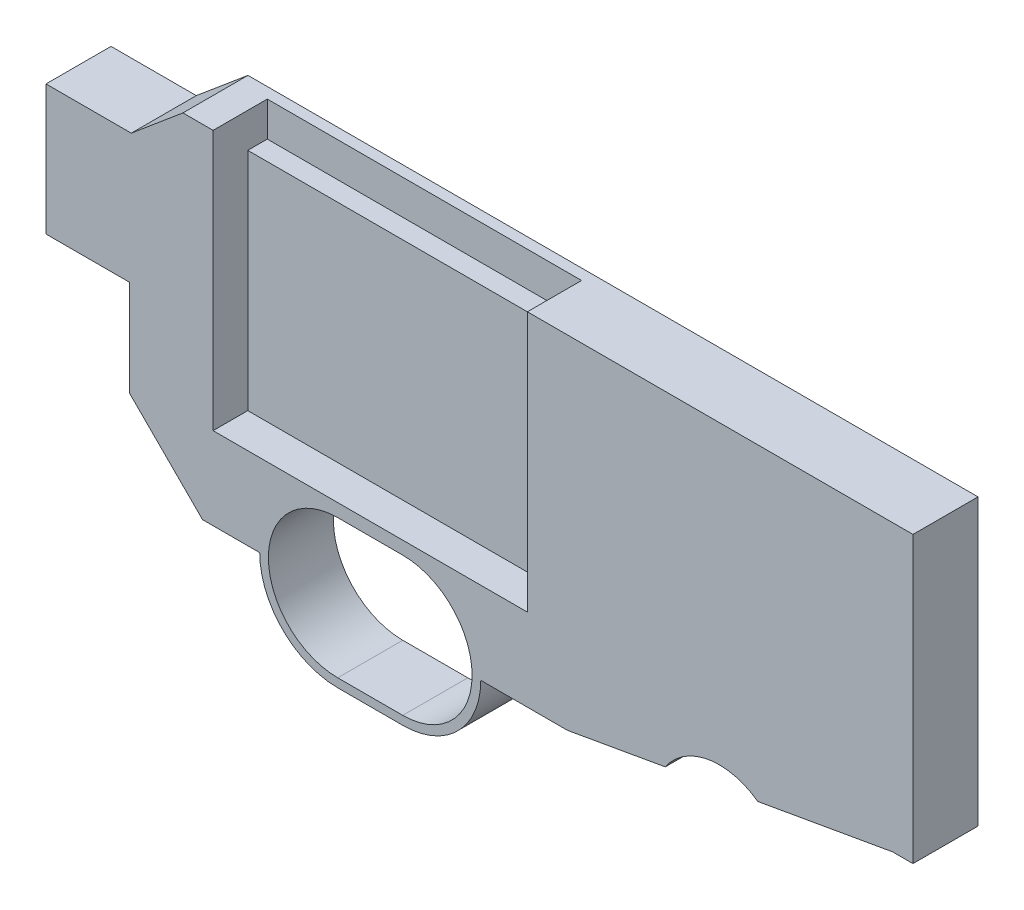
from build123d import *

# Parameters (mm, degrees)
EXTRUDE_1_DEPTH     = 15
SKETCH_2_W          = 72.5
SKETCH_2_H          = 52
CUT_EXTRUDE_1_DEPTH = 8
SKETCH_3_W          = 72.5
SKETCH_3_H          = 8
CUT_EXTRUDE_4_DEPTH = 12.5


with BuildPart() as part:
    # 스케치1 → 보스-돌출1 (new body)
    with BuildSketch(Plane.XY):
        with BuildLine():
            Line((19.671242882, 0), (0, 0))
            Line((0, 0), (0, -30))
            Line((0, -30), (19.298724865, -30))
            Line((19.298724865, -30), (19.298724865, -52.187391743))
            Line((19.298724865, -52.187391743), (36.111333122, -69))
            Line((36.111333122, -69), (49.298724865, -69))
            ThreePointArc((49.298724865, -69), (54.570802804, -81.727922061), (67.298724865, -87))
            Line((67.298724865, -87), (82.298724865, -87))
            ThreePointArc((82.298724865, -87), (95.026646927, -81.727922061), (100.298724865, -69))
            Line((100.298724865, -69), (120.298724865, -69))
            Line((120.298724865, -69), (142.85786008, -65.0222158))
            ThreePointArc((142.85786008, -65.0222158), (152.722113491, -58.588242921), (164.192027956, -61.260426393))
            Line((164.192027956, -61.260426393), (195.298724865, -55.775476447))
            Line((195.298724865, -55.775476447), (200, -55.775476447))
            Line((200, -55.775476447), (200, 10))
            Line((200, 10), (31.588778808, 10))
            Line((31.588778808, 10), (19.671242882, 0))
        make_face()
        with BuildLine():
            ThreePointArc((67.298724865, -85), (51.298724865, -69), (67.298724865, -53))
            Line((67.298724865, -53), (82.298724865, -53))
            ThreePointArc((82.298724865, -53), (98.298724865, -69), (82.298724865, -85))
            Line((82.298724865, -85), (67.298724865, -85))
        make_face(mode=Mode.SUBTRACT)
    extrude(amount=EXTRUDE_1_DEPTH)

    # 스케치2 → 컷-돌출1 (cut)
    with BuildSketch(Plane.XY.offset(15)):
        with Locations((74.798724865, -24)):
            Rectangle(SKETCH_2_W, SKETCH_2_H)
    extrude(amount=-CUT_EXTRUDE_1_DEPTH, mode=Mode.SUBTRACT)

    # 스케치3 → 컷-돌출4 (cut)
    with BuildSketch(Plane.XY.offset(15)):
        with Locations((74.798724865, 6)):
            Rectangle(SKETCH_3_W, SKETCH_3_H)
    extrude(amount=-CUT_EXTRUDE_4_DEPTH, mode=Mode.SUBTRACT)


solid = part.part
